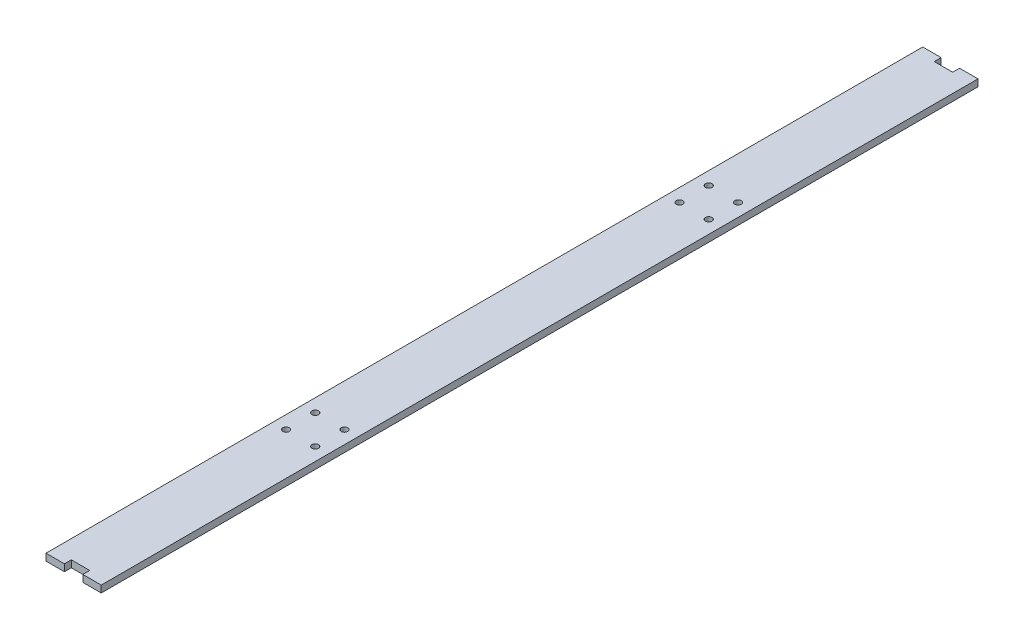
from build123d import *

# Parameters (mm, degrees)
SKETCH2_W           = 25.4
SKETCH2_H           = 403.225
BOSS_EXTRUDE1_DEPTH = 3.175
SKETCH3_W           = 8.466666666
SKETCH3_H           = 3.175
CUT_EXTRUDE1_DEPTH  = 3.175
CUT_EXTRUDE2_DEPTH  = 3.175


with BuildPart() as part:
    # Sketch2 → Boss-Extrude1 (new body)
    with BuildSketch(Plane(origin=(0, 0, 0), x_dir=(1, 0, 0), z_dir=(0, 1, 0))):
        Rectangle(SKETCH2_W, SKETCH2_H)
    extrude(amount=BOSS_EXTRUDE1_DEPTH)

    # Sketch3 → Cut-Extrude1 (cut)
    with BuildSketch(Plane(origin=(0, 3.175, 0), x_dir=(1, 0, 0), z_dir=(0, 1, 0))):
        with Locations((0, 200.025)):
            Rectangle(SKETCH3_W, SKETCH3_H)
    cut_extrude1 = extrude(amount=-CUT_EXTRUDE1_DEPTH, mode=Mode.SUBTRACT)

    # Mirror1: Cut-Extrude1 across plane
    add(cut_extrude1.mirror(Plane.XY), mode=Mode.SUBTRACT)

    # Sketch5 → Cut-Extrude2 (cut)
    with BuildSketch(Plane(origin=(0, 3.175, 0), x_dir=(1, 0, 0), z_dir=(0, 1, 0))):
        with BuildLine():
            ThreePointArc((8.217514421, -83.769985579), (6.717514421, -82.269985579), (5.217514421, -83.769985579))
            Line((5.217514421, -83.769985579), (6.717514421, -83.769985579))
            Line((6.717514421, -83.769985579), (6.717514421, -85.269985579))
            ThreePointArc((6.717514421, -85.269985579), (7.778174593, -84.830645751), (8.217514421, -83.769985579))
        make_face()
        with BuildLine():
            Line((6.717514421, -83.769985579), (5.217514421, -83.769985579))
            ThreePointArc((5.217514421, -83.769985579), (5.656854249, -84.830645751), (6.717514421, -85.269985579))
            Line((6.717514421, -85.269985579), (6.717514421, -83.769985579))
        make_face()
        with BuildLine():
            Line((-6.717514421, -85.269985579), (-6.717514421, -83.769985579))
            Line((-6.717514421, -83.769985579), (-5.217514421, -83.769985579))
            ThreePointArc((-5.217514421, -83.769985579), (-7.778174593, -82.709325407), (-6.717514421, -85.269985579))
        make_face()
        with BuildLine():
            Line((-5.217514421, -83.769985579), (-6.717514421, -83.769985579))
            Line((-6.717514421, -83.769985579), (-6.717514421, -85.269985579))
            ThreePointArc((-6.717514421, -85.269985579), (-5.656854249, -84.830645751), (-5.217514421, -83.769985579))
        make_face()
        with BuildLine():
            ThreePointArc((-5.217514421, -97.205014421), (-5.656854249, -96.144354249), (-6.717514421, -95.705014421))
            Line((-6.717514421, -95.705014421), (-6.717514421, -97.205014421))
            Line((-6.717514421, -97.205014421), (-5.217514421, -97.205014421))
        make_face()
        with BuildLine():
            Line((-6.717514421, -97.205014421), (-6.717514421, -95.705014421))
            ThreePointArc((-6.717514421, -95.705014421), (-7.778174593, -98.265674593), (-5.217514421, -97.205014421))
            Line((-5.217514421, -97.205014421), (-6.717514421, -97.205014421))
        make_face()
        with BuildLine():
            ThreePointArc((8.217514421, -97.205014421), (7.778174593, -96.144354249), (6.717514421, -95.705014421))
            Line((6.717514421, -95.705014421), (6.717514421, -97.205014421))
            Line((6.717514421, -97.205014421), (5.217514421, -97.205014421))
            ThreePointArc((5.217514421, -97.205014421), (6.717514421, -98.705014421), (8.217514421, -97.205014421))
        make_face()
        with BuildLine():
            Line((6.717514421, -97.205014421), (6.717514421, -95.705014421))
            ThreePointArc((6.717514421, -95.705014421), (5.656854249, -96.144354249), (5.217514421, -97.205014421))
            Line((5.217514421, -97.205014421), (6.717514421, -97.205014421))
        make_face()
    cut_extrude2 = extrude(amount=-CUT_EXTRUDE2_DEPTH, mode=Mode.SUBTRACT)

    # Mirror2: Cut-Extrude2 across plane
    add(cut_extrude2.mirror(Plane.XY), mode=Mode.SUBTRACT)


solid = part.part
